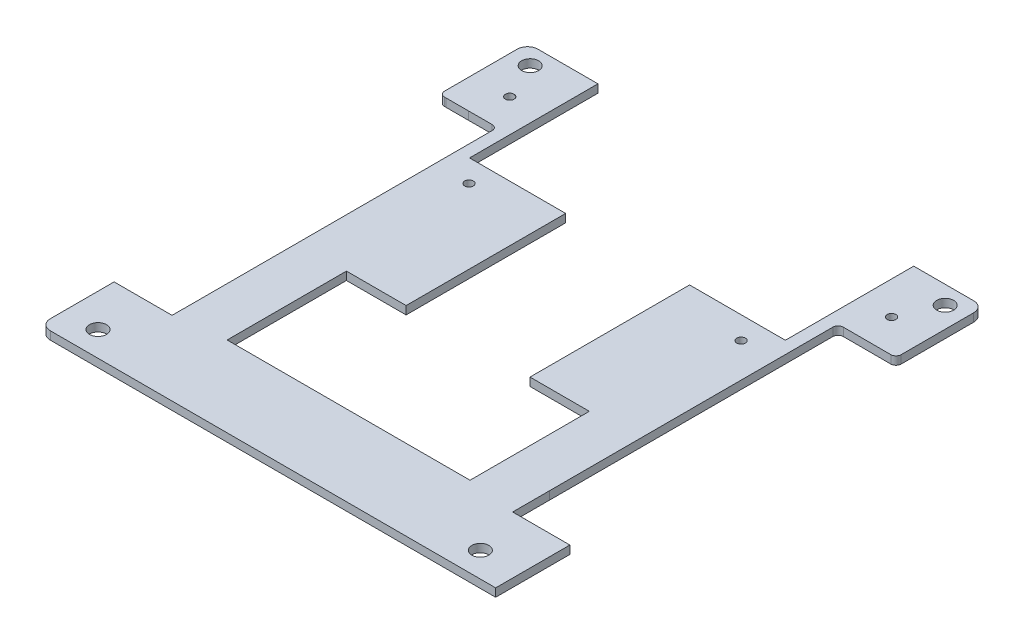
from build123d import *

# Parameters (mm, degrees)
SKETCH1_2_R         = 1.6383
SKETCH1_2_R_2       = 0.8382
BOSS_EXTRUDE2_DEPTH = 1.575
SKETCH2_W           = 14.080651801
SKETCH2_H           = 7.11628052
SKETCH2_W_2         = 15.007196354
SKETCH2_H_2         = 9.421332762
CUT_EXTRUDE1_DEPTH  = 65.400942629


with BuildPart() as part:
    # Sketch1<2> → Boss-Extrude2 (new body)
    with BuildSketch(Plane(origin=(0, 0, 0), x_dir=(1, 0, 0), z_dir=(0, 1, 0))):
        with BuildLine():
            Line((-38.39500299, 29.999999735), (-42.73000299, 29.999999735))
            Line((-42.73000299, 29.999999735), (-43.011025994, 30.003097626))
            ThreePointArc((-43.011025994, 30.003097626), (-43.710996344, 30.299838092), (-44.000003042, 31.003036872))
            Line((-44.000003042, 31.003036872), (-44.000003042, 31.269999735))
            Line((-44.000003042, 31.269999735), (-44.000005679, 44.999999735))
            ThreePointArc((-44.000005679, 44.999999735), (-43.414218633, 46.414215608), (-42.000002924, 47.000003051))
            Line((-42.000002924, 47.000003051), (-30.435003, 47.000003051))
            Line((-30.435003, 47.000003051), (-30.435003, 22.255357341))
            Line((-30.435003, 22.255357341), (-11.909003, 22.255357341))
            Line((-11.909003, 22.255357341), (-11.909003, -8.5))
            Line((-11.909003, -8.5), (-23.409003, -8.5))
            Line((-23.409003, -8.5), (-23.409003, -31.499996949))
            Line((-23.409003, -31.499996949), (23.408997, -31.499996949))
            Line((23.408997, -31.499996949), (23.408997, -8.499997555))
            Line((23.408997, -8.499997555), (11.97084713, -8.499997555))
            Line((11.97084713, -8.499997555), (11.97084713, 22.255357341))
            Line((11.97084713, 22.255357341), (30.434997, 22.255357341))
            Line((30.434997, 22.255357341), (30.434997, 47.000003051))
            Line((30.434997, 47.000003051), (42.000008541, 47.000003051))
            ThreePointArc((42.000008541, 47.000003051), (43.414213215, 46.414220704), (43.999996956, 45.000016607))
            Line((43.999996956, 45.000016607), (43.999996956, 32.000003378))
            Line((43.999996956, 32.000003378), (43.999996956, 31.015615364))
            ThreePointArc((43.999996956, 31.015615364), (43.706534093, 30.307939396), (42.998386406, 30.015616661))
            Line((42.998386406, 30.015616661), (33.825607551, 30.030389905))
            ThreePointArc((33.825607551, 30.030389905), (33.117459864, 29.738067169), (32.823997, 29.030391202))
            Line((32.823997, 29.030391202), (32.823997, -30.453996949))
            ThreePointArc((32.823997, -30.453996949), (33.116890219, -31.16110373), (33.823997, -31.453996949))
            Line((33.823997, -31.453996949), (36.099999555, -31.453996949))
            Line((36.099999555, -31.453996949), (42.849728118, -31.453996949))
            ThreePointArc((42.849728118, -31.453996949), (43.556834899, -31.746890168), (43.849728118, -32.453996949))
            Line((43.849728118, -32.453996949), (43.849728118, -36.999996949))
            Line((43.849728118, -36.999996949), (43.849728118, -46.999996949))
            Line((43.849728118, -46.999996949), (-42.000000178, -46.999996949))
            ThreePointArc((-42.000000178, -46.999996949), (-43.414212804, -46.414211581), (-44.000000499, -44.999999921))
            Line((-44.000000499, -44.999999921), (-44.000000178, -38.976999921))
            Line((-44.000000178, -38.976999921), (-44.000000178, -32.453999802))
            ThreePointArc((-44.000000178, -32.453999802), (-43.70710696, -31.746893021), (-43.000000178, -31.453999802))
            Line((-43.000000178, -31.453999802), (-36.100000549, -31.453999802))
            Line((-36.100000549, -31.453999802), (-33.824003042, -31.453999802))
            ThreePointArc((-33.824003042, -31.453999802), (-33.116896261, -31.161106583), (-32.824003042, -30.453999802))
            Line((-32.824003042, -30.453999802), (-32.824003042, 29.011483943))
            ThreePointArc((-32.824003042, 29.011483943), (-33.117785331, 29.719478678), (-33.826516131, 30.011480785))
            Line((-33.826516131, 30.011480785), (-38.39500299, 29.999999735))
        make_face()
        with Locations((40, 43.5)):
            Circle(SKETCH1_2_R, mode=Mode.SUBTRACT)
        with Locations((-40, 43.5)):
            Circle(SKETCH1_2_R, mode=Mode.SUBTRACT)
        with Locations((-37.6, -42.2)):
            Circle(SKETCH1_2_R, mode=Mode.SUBTRACT)
        with Locations((36.1, -42.2)):
            Circle(SKETCH1_2_R, mode=Mode.SUBTRACT)
        with Locations((-36.785003, 36.350003051)):
            Circle(SKETCH1_2_R_2, mode=Mode.SUBTRACT)
        with Locations((-26.220003, 17.93193176)):
            Circle(SKETCH1_2_R_2, mode=Mode.SUBTRACT)
        with Locations((26.219997, 17.93193176)):
            Circle(SKETCH1_2_R_2, mode=Mode.SUBTRACT)
        with Locations((36.784997, 36.368003051)):
            Circle(SKETCH1_2_R_2, mode=Mode.SUBTRACT)
    extrude(amount=BOSS_EXTRUDE2_DEPTH)

    # Sketch2 → Cut-Extrude1 (cut, through all)
    with BuildSketch(Plane(origin=(0, 1.575, 0), x_dir=(1, 0, 0), z_dir=(0, 1, 0))):
        with Locations((39.863054019, -29.135856689)):
            Rectangle(SKETCH2_W, SKETCH2_H)
        with Locations((-40.336598676, -27.983330568)):
            Rectangle(SKETCH2_W_2, SKETCH2_H_2)
    extrude(amount=-CUT_EXTRUDE1_DEPTH, mode=Mode.SUBTRACT)


solid = part.part
